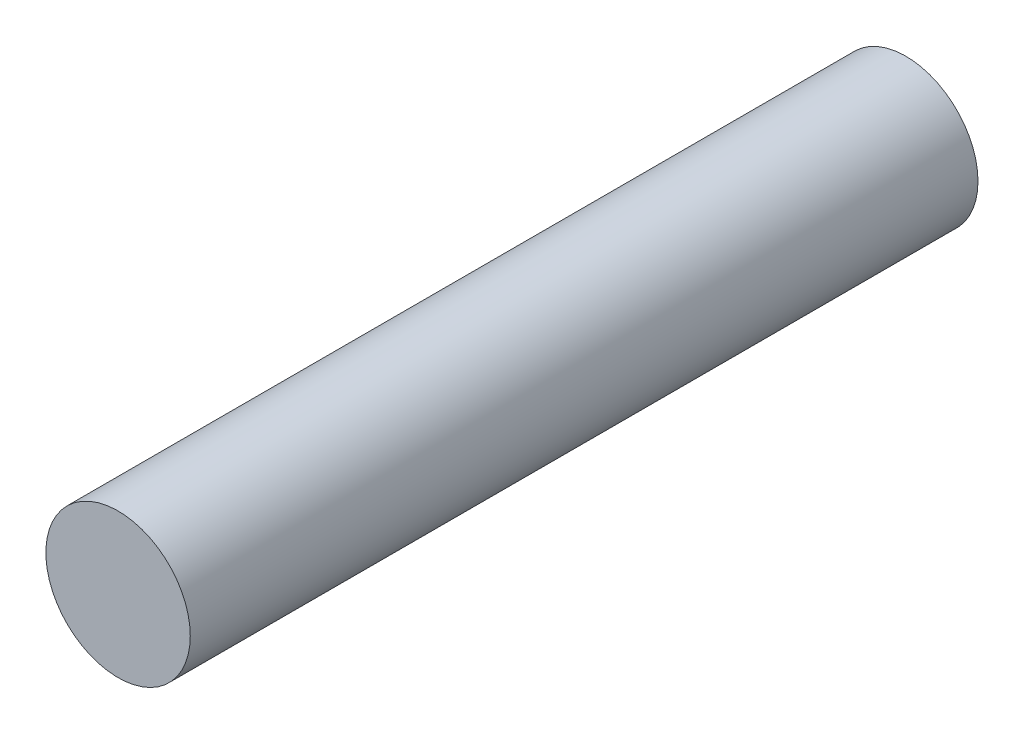
from build123d import *

# Parameters (mm, degrees)
SKETCH_1_R      = 5.5
EXTRUDE_1_DEPTH = 60


with BuildPart() as part:
    # 草图1 → 凸台-拉伸1 (new body)
    with BuildSketch(Plane.XY):
        Circle(SKETCH_1_R)
    extrude(amount=EXTRUDE_1_DEPTH)


solid = part.part
